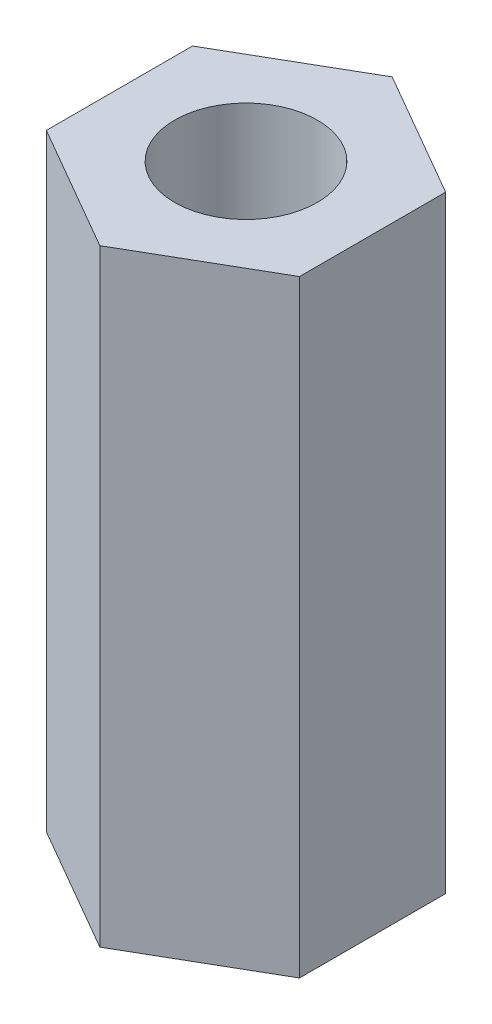
from build123d import *

# Parameters (mm, degrees)
SKETCH1_R           = 1.41
BOSS_EXTRUDE1_DEPTH = 12


with BuildPart() as part:
    # Sketch1 → Boss-Extrude1 (new body)
    with BuildSketch(Plane(origin=(0, 0, 0), x_dir=(1, 0, 0), z_dir=(0, 1, 0))):
        Polygon((0, 2.887), (2.500215341, 1.4435), (2.500215341, -1.4435), (0, -2.887), (-2.500215341, -1.4435), (-2.500215341, 1.4435), align=None)
        with Locations(Location((0, 0, 0), (0, 0, 270))):
            Circle(SKETCH1_R, mode=Mode.SUBTRACT)
    extrude(amount=BOSS_EXTRUDE1_DEPTH)


solid = part.part
